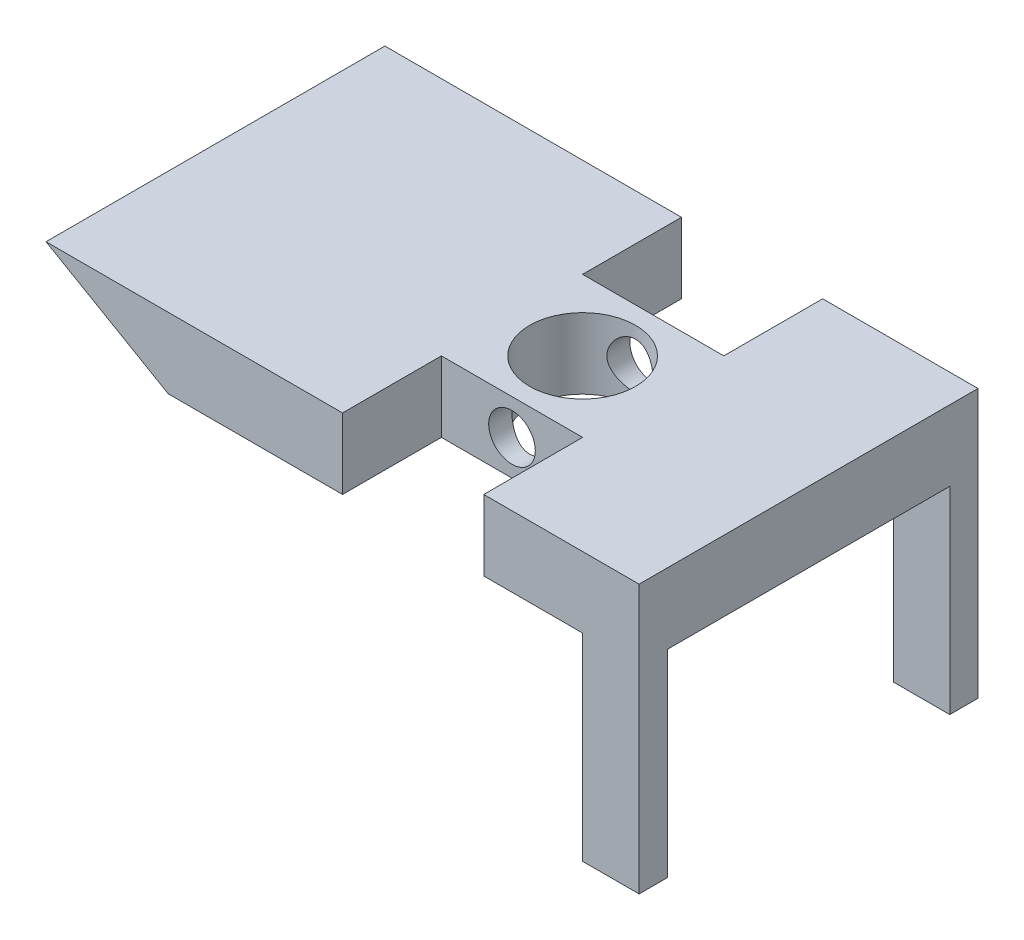
from build123d import *

# Parameters (mm, degrees)
BOSS_EXTRUDE1_DEPTH = 12
CUT_EXTRUDE1_REACH  = 33.988
SKETCH4_R           = 1.65
SKETCH4_3_W         = 10
SKETCH4_3_H         = 5
SKETCH4_3_R         = 1.65
CUT_EXTRUDE3_DEPTH  = 7
CUT_EXTRUDE2_REACH  = 26.698
SKETCH5_R           = 3.75
SKETCH6_W           = 4
SKETCH6_H           = 14
BOSS_EXTRUDE2_DEPTH = 24
SKETCH7_W           = 20
SKETCH7_H           = 14
CUT_EXTRUDE4_DEPTH  = 10


with BuildPart() as part:
    # Sketch3 → Boss-Extrude1 (new, symmetric)
    with BuildSketch(Plane.XY):
        Polygon((-21, 2.5), (-12.339745962, -2.5), (21, -2.5), (21, 2.5), align=None)
    extrude(amount=BOSS_EXTRUDE1_DEPTH, both=True)

    # Sketch4 → Cut-Extrude1 (cut, up to next)
    with BuildSketch(Plane.XY.offset(12), mode=Mode.PRIVATE) as cut_extrude1_sk1:
        with Locations((5, 0)):
            Circle(SKETCH4_R)
    cut_extrude1_tool1 = extrude(cut_extrude1_sk1.sketch, amount=-CUT_EXTRUDE1_REACH, mode=Mode.PRIVATE) & part.part
    add(cut_extrude1_tool1.solids().sort_by_distance((5, 0, 12))[0], mode=Mode.SUBTRACT)

    # Sketch4<3> → Cut-Extrude3 (cut)
    with BuildSketch(Plane.XY.offset(12)):
        with Locations((5, 0)):
            Rectangle(SKETCH4_3_W, SKETCH4_3_H)
        with Locations((5, 0)):
            Circle(SKETCH4_3_R, mode=Mode.SUBTRACT)
    cut_extrude3 = extrude(amount=-CUT_EXTRUDE3_DEPTH, mode=Mode.SUBTRACT)

    # Mirror1: Cut-Extrude3 across plane
    add(cut_extrude3.mirror(Plane.XY), mode=Mode.SUBTRACT)

    # Sketch5 → Cut-Extrude2 (cut, up to next)
    with BuildSketch(Plane(origin=(0, 2.5, 0), x_dir=(1, 0, 0), z_dir=(0, 1, 0)), mode=Mode.PRIVATE) as cut_extrude2_sk1:
        with Locations(Location((5, 0, 0), (0, 0, 270))):
            Circle(SKETCH5_R)
    cut_extrude2_tool1 = extrude(cut_extrude2_sk1.sketch, amount=-CUT_EXTRUDE2_REACH, mode=Mode.PRIVATE) & part.part
    add(cut_extrude2_tool1.solids().sort_by_distance((5, 2.5, 0))[0], mode=Mode.SUBTRACT)

    # Sketch6 → Boss-Extrude2 (add)
    with BuildSketch(Plane.XY.offset(12)):
        with Locations((19, -9.5)):
            Rectangle(SKETCH6_W, SKETCH6_H)
    extrude(amount=-BOSS_EXTRUDE2_DEPTH)

    # Sketch7 → Cut-Extrude4 (cut)
    with BuildSketch(Plane(origin=(21, 0, 0), x_dir=(0, 0, -1), z_dir=(1, 0, 0))):
        with Locations((0, -9.5)):
            Rectangle(SKETCH7_W, SKETCH7_H)
    extrude(amount=-CUT_EXTRUDE4_DEPTH, mode=Mode.SUBTRACT)


solid = part.part
